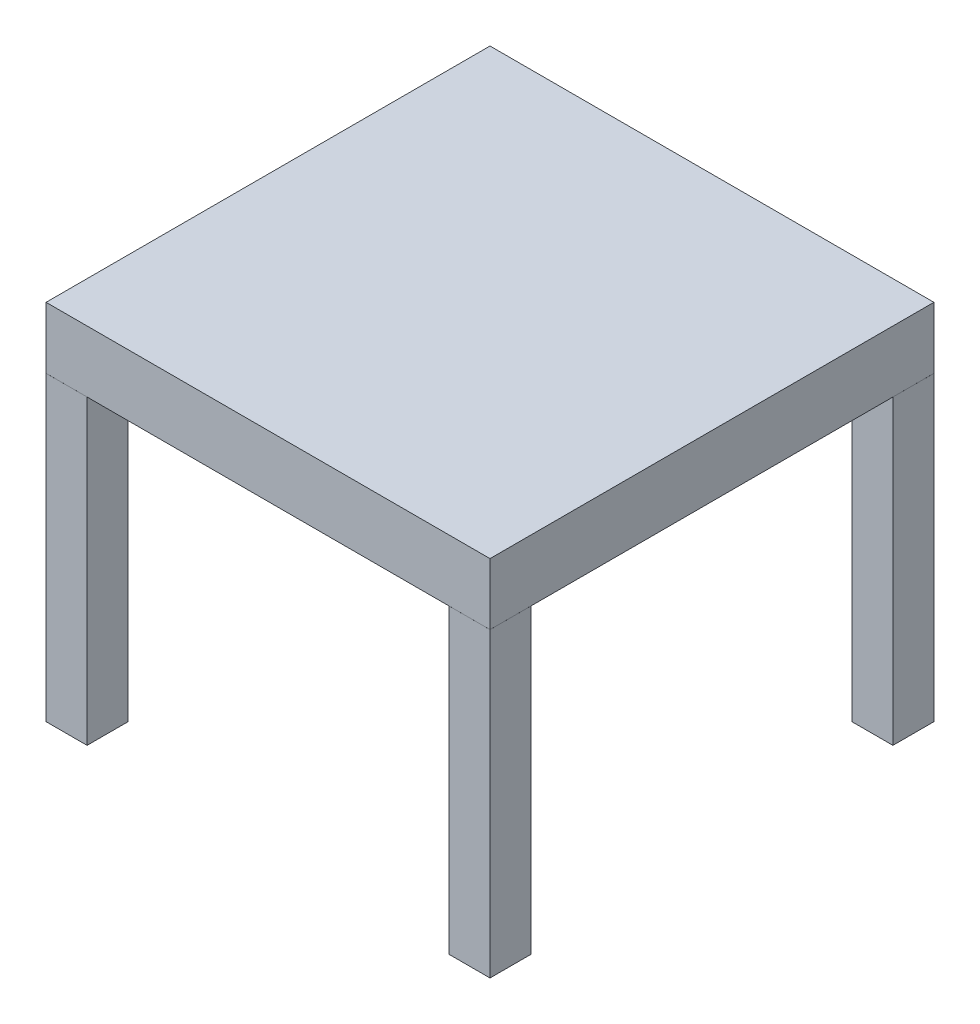
from build123d import *

# Parameters (mm, degrees)
SKETCH3_W               = 550
SKETCH3_H               = 550
BOSS_EXTRUDE2_DEPTH     = 38.1
SKETCH5_W               = 50.8
SKETCH5_H               = 50.8
BOSS_EXTRUDE3_DEPTH     = 373.8
CUT_EXTRUDE1_DEPTH      = 741.126077098
CUT_EXTRUDE1_DEPTH_BACK = 741.126077098
SKETCH6_W               = 655.630835137
SKETCH6_H               = 0.0254


with BuildPart() as part:
    # Sketch3 → Boss-Extrude2 (new, symmetric)
    with BuildSketch(Plane(origin=(0, 0, 0), x_dir=(1, 0, 0), z_dir=(0, 1, 0))):
        Rectangle(SKETCH3_W, SKETCH3_H)
    extrude(amount=BOSS_EXTRUDE2_DEPTH, both=True)

    # Sketch5 → Boss-Extrude3 (add)
    with BuildSketch(Plane.XZ.offset(38.1)):
        with Locations((249.6, 249.6)):
            Rectangle(SKETCH5_W, SKETCH5_H)
        with Locations((249.6, -249.6)):
            Rectangle(SKETCH5_W, SKETCH5_H)
        with Locations((-249.6, -249.6)):
            Rectangle(SKETCH5_W, SKETCH5_H)
        with Locations((-249.6, 249.6)):
            Rectangle(SKETCH5_W, SKETCH5_H)
    extrude(amount=BOSS_EXTRUDE3_DEPTH)

    # Sketch6 → Cut-Extrude1 (cut, two sides: drawn at the far end of the back side and taken through both)
    with BuildSketch(Plane(origin=(275, 0, 0), x_dir=(0, 0, -1), z_dir=(1, 0, 0)).offset(-CUT_EXTRUDE1_DEPTH_BACK)):
        with Locations((32.666920981, -38.1127)):
            Rectangle(SKETCH6_W, SKETCH6_H)
    extrude(amount=CUT_EXTRUDE1_DEPTH + CUT_EXTRUDE1_DEPTH_BACK, mode=Mode.SUBTRACT)


with BuildPart() as cut_extrude1_piece_1:
    # of the separate pieces the step leaves, piece 1, a body of its own (cut_extrude1_pieces)
    add(part.part.solids().sort_by_distance((-275, -38.1, -275))[0])


with BuildPart() as cut_extrude1_piece_2:
    # of the separate pieces the step leaves, piece 2, a body of its own (cut_extrude1_pieces)
    add(part.part.solids().sort_by_distance((275, -38.1254, 224.2))[0])


with BuildPart() as cut_extrude1_piece_3:
    # of the separate pieces the step leaves, piece 3, a body of its own (cut_extrude1_pieces)
    add(part.part.solids().sort_by_distance((-275, -411.9, 275))[0])


with BuildPart() as cut_extrude1_piece_4:
    # of the separate pieces the step leaves, piece 4, a body of its own (cut_extrude1_pieces)
    add(part.part.solids().sort_by_distance((-275, -411.9, -275))[0])


with BuildPart() as cut_extrude1_piece_5:
    # of the separate pieces the step leaves, piece 5, a body of its own (cut_extrude1_pieces)
    add(part.part.solids().sort_by_distance((224.2, -38.1254, -275))[0])


solid = Compound([cut_extrude1_piece_1.part, cut_extrude1_piece_2.part, cut_extrude1_piece_3.part, cut_extrude1_piece_4.part, cut_extrude1_piece_5.part])
